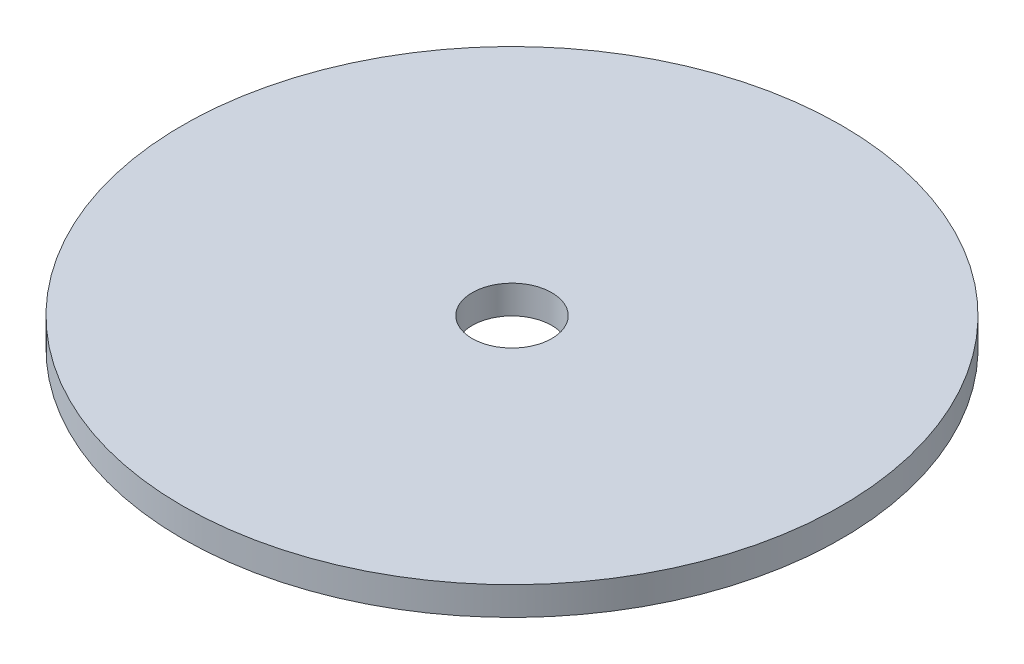
from build123d import *

# Parameters (mm, degrees)
SKETCH1_R           = 29
SKETCH1_R_2         = 3.5
BOSS_EXTRUDE1_DEPTH = 2.5


with BuildPart() as part:
    # Sketch1 → Boss-Extrude1 (new body)
    with BuildSketch(Plane(origin=(0, 0, 0), x_dir=(1, 0, 0), z_dir=(0, 1, 0))):
        with Locations(Location((0, 0, 0), (0, 0, 270))):
            Circle(SKETCH1_R)
        with Locations(Location((0, 0, 0), (0, 0, 270))):
            Circle(SKETCH1_R_2, mode=Mode.SUBTRACT)
    extrude(amount=BOSS_EXTRUDE1_DEPTH)


solid = part.part
